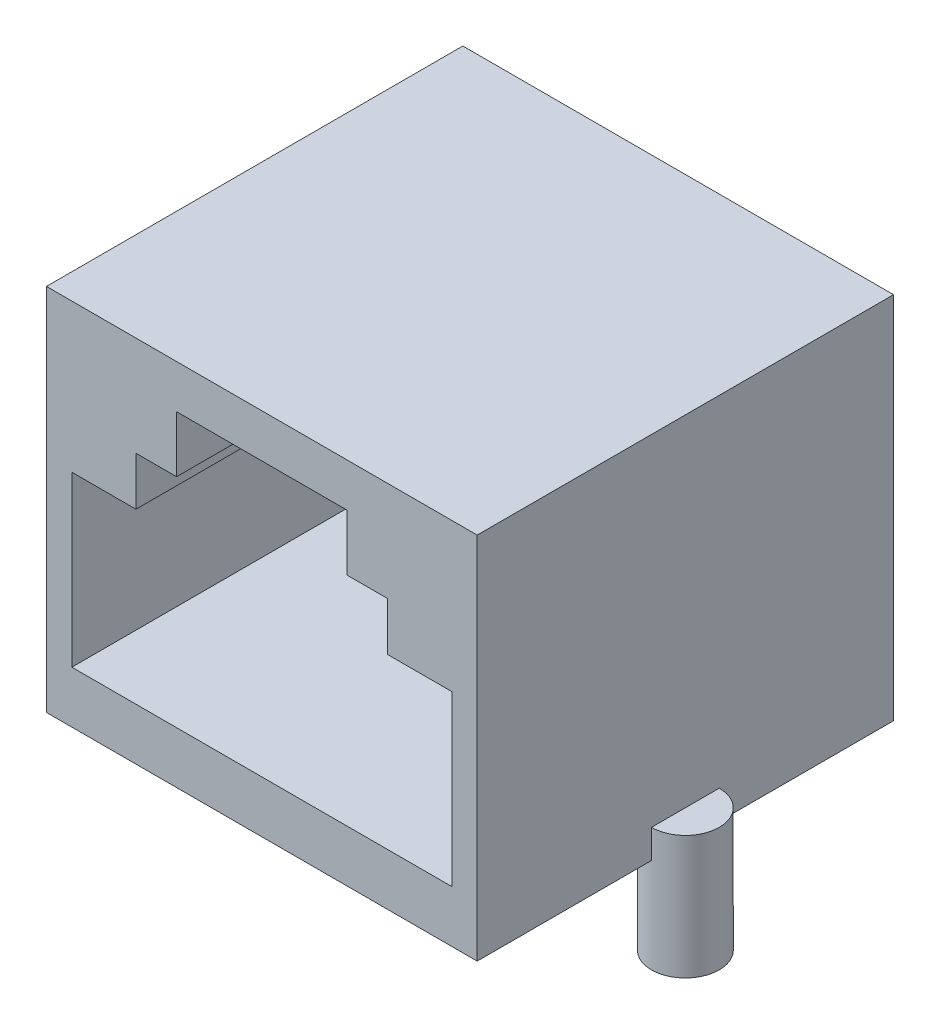
from build123d import *

# Parameters (mm, degrees)
SKETCH_1_W           = 15
SKETCH_1_H           = 14.5
EXTRUDE_1_DEPTH      = 12.85
EXTRUDE_2_DEPTH      = 3.3
EXTRUDE_2_DEPTH_BACK = 1
SKETCH_2_R           = 1.18
CUT_EXTRUDE_1_DEPTH  = 10


with BuildPart() as part:
    # 草图1 → 凸台-拉伸1 (new body)
    with BuildSketch(Plane(origin=(0, 0, 0), x_dir=(1, 0, 0), z_dir=(0, 1, 0))):
        Rectangle(SKETCH_1_W, SKETCH_1_H)
    extrude(amount=EXTRUDE_1_DEPTH)

    # 草图2 → 凸台-拉伸2 (add, two sides: drawn at the far end of the back side and taken through both)
    with BuildSketch(Plane.XZ.offset(-EXTRUDE_2_DEPTH_BACK)):
        with Locations(Location((-7.5, 0, 0), (0, 0, 270))):
            Circle(SKETCH_2_R)
        with Locations(Location((7.5, 0, 0), (0, 0, 90))):
            Circle(SKETCH_2_R)
    extrude(amount=EXTRUDE_2_DEPTH + EXTRUDE_2_DEPTH_BACK)

    # 草图3 → 切除-拉伸1 (cut)
    with BuildSketch(Plane.XY.offset(7.25)):
        Polygon((2.967608293, 11.336409161), (-2.967608293, 11.336409161), (-2.967608293, 9.376154142), (-4.383348029, 9.376154142), (-4.383348029, 7.688156764), (-6.615860689, 7.688156764), (-6.615860689, 1.807391707), (6.615860689, 1.807391707), (6.615860689, 7.688156764), (4.383348029, 7.688156764), (4.383348029, 9.376154142), (2.967608293, 9.376154142), align=None)
    extrude(amount=-CUT_EXTRUDE_1_DEPTH, mode=Mode.SUBTRACT)


solid = part.part
